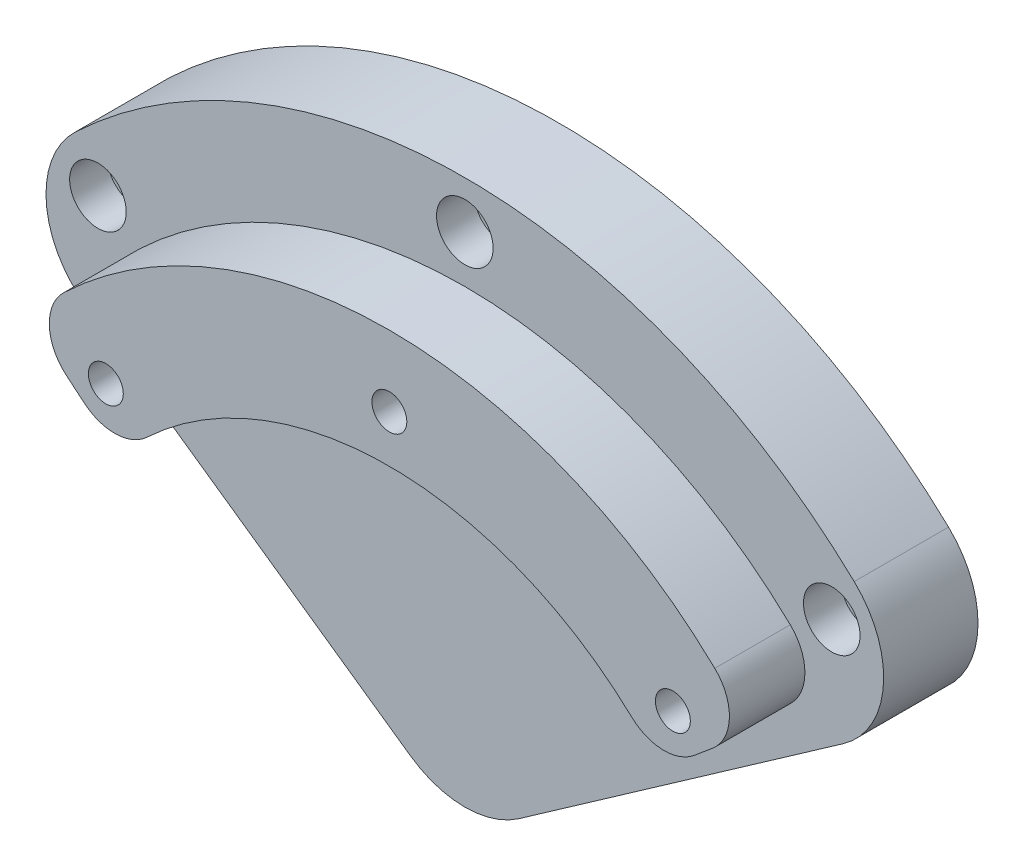
from build123d import *

# Parameters (mm, degrees)
EXTRUDE_1_DEPTH     = 10
FILLET_1_R          = 10
SKETCH_2_R          = 1.6
CUT_EXTRUDE_1_DEPTH = 10
SKETCH_3_R          = 1.85
EXTRUDE_2_DEPTH     = 8
FILLET_2_R          = 5
SKETCH_4_R          = 1.85
CUT_EXTRUDE_2_DEPTH = 77.777966908
SKETCH_5_R          = 3.25
SKETCH_5_R_2        = 1.85
CUT_EXTRUDE_3_DEPTH = 5
SKETCH_7_R          = 3
CUT_EXTRUDE_5_DEPTH = 4


with BuildPart() as part:
    # 草图1 → 凸台-拉伸1 (new body)
    with BuildSketch(Plane.XY):
        with BuildLine():
            ThreePointArc((49.149122657, 34.414586181), (0, 60), (-49.149122657, 34.414586181))
            Line((-49.149122657, 34.414586181), (0, 0))
            Line((0, 0), (49.149122657, 34.414586181))
        make_face()
    extrude(amount=EXTRUDE_1_DEPTH)

    # 圆角1
    fillet_1_edges = [part.edges().sort_by_distance(p)[0] for p in [
        (49.149122657, 34.414586181, 5),
        (-49.149122657, 34.414586181, 5),
        (0, 0, 5),
    ]]
    fillet(fillet_1_edges, radius=FILLET_1_R)

    # 草图2 → 切除-拉伸1 (cut)
    with BuildSketch(Plane.XY.offset(10)):
        with Locations((38.890872965, 38.890872965)):
            Circle(SKETCH_2_R)
        with Locations((-38.890872965, 38.890872965)):
            Circle(SKETCH_2_R)
        with Locations((0, 55)):
            Circle(SKETCH_2_R)
    extrude(amount=-CUT_EXTRUDE_1_DEPTH, mode=Mode.SUBTRACT)

    # 草图3 → 凸台-拉伸2 (add)
    with BuildSketch(Plane.XY.offset(10)):
        with BuildLine():
            Line((28.726666617, 24.104535363), (38.302222156, 32.139380484))
            ThreePointArc((38.302222156, 32.139380484), (0, 50), (-38.302222156, 32.139380484))
            Line((-38.302222156, 32.139380484), (-28.726666617, 24.104535363))
            ThreePointArc((-28.726666617, 24.104535363), (0, 37.5), (28.726666617, 24.104535363))
        make_face()
        with Locations((0, 42.5)):
            Circle(SKETCH_3_R, mode=Mode.SUBTRACT)
        with Locations((30.0520382, 30.0520382)):
            Circle(SKETCH_3_R, mode=Mode.SUBTRACT)
        with Locations((-30.0520382, 30.0520382)):
            Circle(SKETCH_3_R, mode=Mode.SUBTRACT)
    extrude(amount=EXTRUDE_2_DEPTH)

    # 圆角2
    fillet_2_edges = [part.edges().sort_by_distance(p)[0] for p in [
        (-38.302222156, 32.139380484, 14),
        (-28.726666617, 24.104535363, 14),
        (28.726666617, 24.104535363, 14),
        (38.302222156, 32.139380484, 14),
    ]]
    fillet(fillet_2_edges, radius=FILLET_2_R)

    # 草图4 → 切除-拉伸2 (cut, through all)
    with BuildSketch(Plane.XY.offset(18)):
        with Locations((30.0520382, 30.0520382)):
            Circle(SKETCH_4_R)
        with Locations((0, 42.5)):
            Circle(SKETCH_4_R)
        with Locations((-30.0520382, 30.0520382)):
            Circle(SKETCH_4_R)
    extrude(amount=-CUT_EXTRUDE_2_DEPTH, mode=Mode.SUBTRACT)

    # 草图5 → 切除-拉伸3 (cut)
    # profile 1 of 3: a face of its own
    with BuildSketch(Plane(origin=(0, 0, 0), x_dir=(-1, 0, 0), z_dir=(0, 0, -1))):
        with Locations((-30.0520382, 30.0520382)):
            Circle(SKETCH_5_R)
        with Locations((-30.0520382, 30.0520382)):
            Circle(SKETCH_5_R_2, mode=Mode.SUBTRACT)
    # profile 2 of 3: a face of its own
    with BuildSketch(Plane(origin=(0, 0, 0), x_dir=(-1, 0, 0), z_dir=(0, 0, -1))):
        with Locations((0, 42.5)):
            Circle(SKETCH_5_R)
        with Locations((0, 42.5)):
            Circle(SKETCH_5_R_2, mode=Mode.SUBTRACT)
    # profile 3 of 3: a face of its own
    with BuildSketch(Plane(origin=(0, 0, 0), x_dir=(-1, 0, 0), z_dir=(0, 0, -1))):
        with Locations((30.0520382, 30.0520382)):
            Circle(SKETCH_5_R)
        with Locations((30.0520382, 30.0520382)):
            Circle(SKETCH_5_R_2, mode=Mode.SUBTRACT)
    extrude(amount=-CUT_EXTRUDE_3_DEPTH, mode=Mode.SUBTRACT)

    # 草图7 → 切除-拉伸5 (cut)
    with BuildSketch(Plane.XY.offset(10)):
        with Locations((-38.890872965, 38.890872965)):
            Circle(SKETCH_7_R)
        with Locations((0, 55)):
            Circle(SKETCH_7_R)
        with Locations((38.890872965, 38.890872965)):
            Circle(SKETCH_7_R)
    extrude(amount=-CUT_EXTRUDE_5_DEPTH, mode=Mode.SUBTRACT)


solid = part.part
